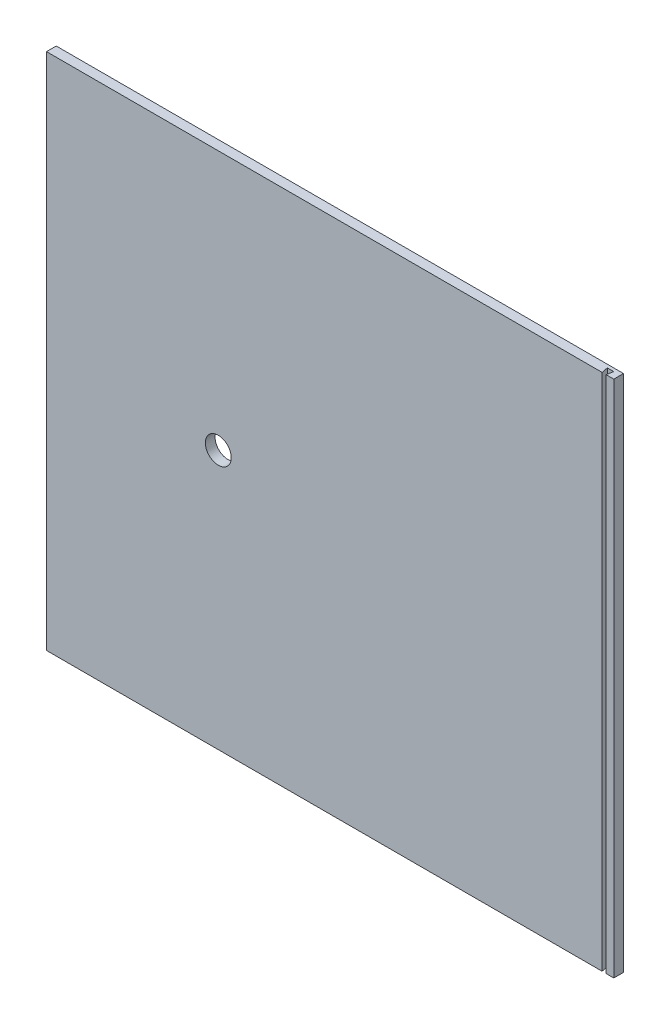
from build123d import *

# Parameters (mm, degrees)
SKETCH1_W           = 87.5
SKETCH1_H           = 80
BOSS_EXTRUDE1_DEPTH = 1.5
CUT_EXTRUDE1_DEPTH  = 80
SKETCH3_R           = 2
CUT_EXTRUDE2_DEPTH  = 1.5


with BuildPart() as part:
    # Sketch1 → Boss-Extrude1 (new body)
    with BuildSketch(Plane.XY):
        with Locations((43.75, 40)):
            Rectangle(SKETCH1_W, SKETCH1_H)
    extrude(amount=BOSS_EXTRUDE1_DEPTH)

    # Sketch2 → Cut-Extrude1 (cut)
    with BuildSketch(Plane(origin=(0, 80, 0), x_dir=(1, 0, 0), z_dir=(0, 1, 0))):
        Polygon((86.5, -0.492887182), (85.5, -0.492887182), (85.7, -1.5), (86.3, -1.5), align=None)
    extrude(amount=-CUT_EXTRUDE1_DEPTH, mode=Mode.SUBTRACT)

    # Sketch3 → Cut-Extrude2 (cut)
    with BuildSketch(Plane(origin=(0, 0, 0), x_dir=(-1, 0, 0), z_dir=(0, 0, -1))):
        with Locations((-26.5, 40)):
            Circle(SKETCH3_R)
    extrude(amount=-CUT_EXTRUDE2_DEPTH, mode=Mode.SUBTRACT)


solid = part.part
